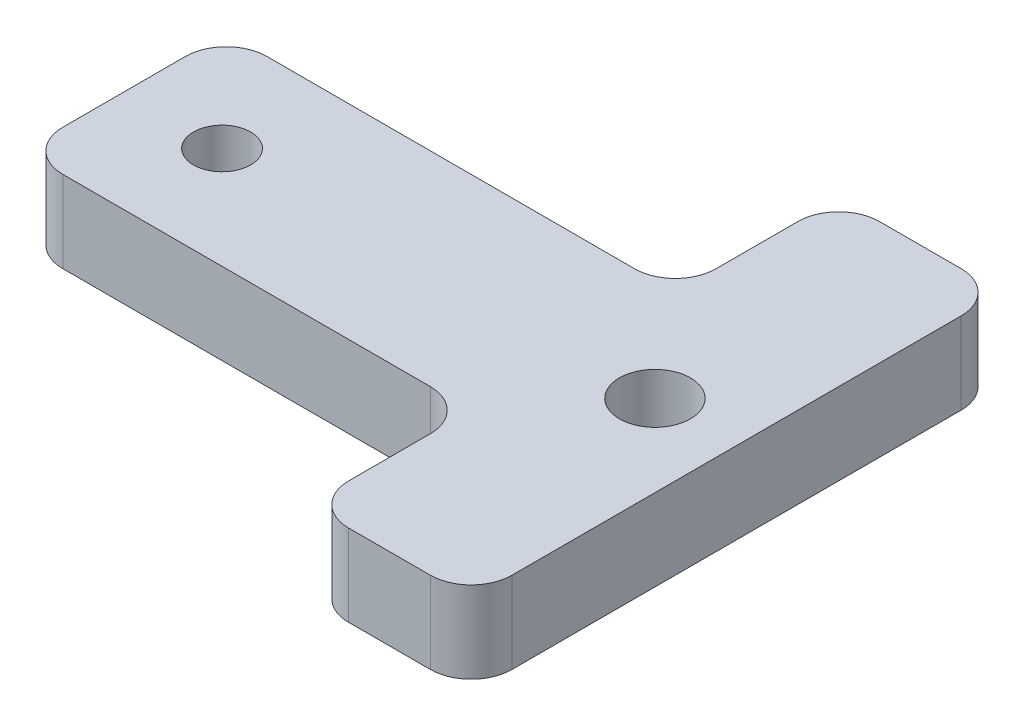
from build123d import *

# Parameters (mm, degrees)
SKETCH1_W           = 20
SKETCH1_H           = 20
SKETCH1_W_2         = 75
SKETCH1_H_2         = 25
BOSS_EXTRUDE1_DEPTH = 10
CUT_EXTRUDE1_REACH  = 52.621
SKETCH2_R           = 3.5
SKETCH2_R_2         = 4.35
FILLET1_R           = 5
SKETCH3_R           = 6
CUT_EXTRUDE2_DEPTH  = 4


with BuildPart() as part:
    # Sketch1 → Boss-Extrude1 (new body)
    with BuildSketch(Plane(origin=(0, 0, 0), x_dir=(1, 0, 0), z_dir=(0, 1, 0))):
        with Locations((27.5, 22.5)):
            Rectangle(SKETCH1_W, SKETCH1_H)
        Rectangle(SKETCH1_W_2, SKETCH1_H_2)
        with Locations((27.5, -22.5)):
            Rectangle(SKETCH1_W, SKETCH1_H)
    extrude(amount=BOSS_EXTRUDE1_DEPTH)

    # Sketch2 → Cut-Extrude1 (cut, up to next)
    with BuildSketch(Plane(origin=(0, 10, 0), x_dir=(1, 0, 0), z_dir=(0, 1, 0)), mode=Mode.PRIVATE) as cut_extrude1_sk1:
        with Locations(Location((-25.5, 0, 0), (0, 0, 270))):
            Circle(SKETCH2_R)
    cut_extrude1_tool1 = extrude(cut_extrude1_sk1.sketch, amount=-CUT_EXTRUDE1_REACH, mode=Mode.PRIVATE) & part.part
    # Sketch2 → Cut-Extrude1 (cut, up to next)
    with BuildSketch(Plane(origin=(0, 10, 0), x_dir=(1, 0, 0), z_dir=(0, 1, 0)), mode=Mode.PRIVATE) as cut_extrude1_sk2:
        with Locations(Location((27.5, 0, 0), (0, 0, 270))):
            Circle(SKETCH2_R_2)
    cut_extrude1_tool2 = extrude(cut_extrude1_sk2.sketch, amount=-CUT_EXTRUDE1_REACH, mode=Mode.PRIVATE) & part.part
    add(cut_extrude1_tool1.solids().sort_by_distance((-25.5, 10, 0))[0], mode=Mode.SUBTRACT)
    add(cut_extrude1_tool2.solids().sort_by_distance((27.5, 10, 0))[0], mode=Mode.SUBTRACT)

    # Fillet1
    fillet1_edges = [part.edges().sort_by_distance(p)[0] for p in [
        (17.5, 5, -32.5),
        (37.5, 5, -32.5),
        (37.5, 5, 32.5),
        (17.5, 5, 32.5),
        (17.5, 5, 12.5),
        (-37.5, 5, 12.5),
        (-37.5, 5, -12.5),
        (17.5, 5, -12.5),
    ]]
    fillet(fillet1_edges, radius=FILLET1_R)

    # Sketch3 → Cut-Extrude2 (cut)
    with BuildSketch(Plane.XZ):
        with Locations(Location((-25.5, 0, 0), (0, 0, 270))):
            Circle(SKETCH3_R)
    extrude(amount=-CUT_EXTRUDE2_DEPTH, mode=Mode.SUBTRACT)


solid = part.part
